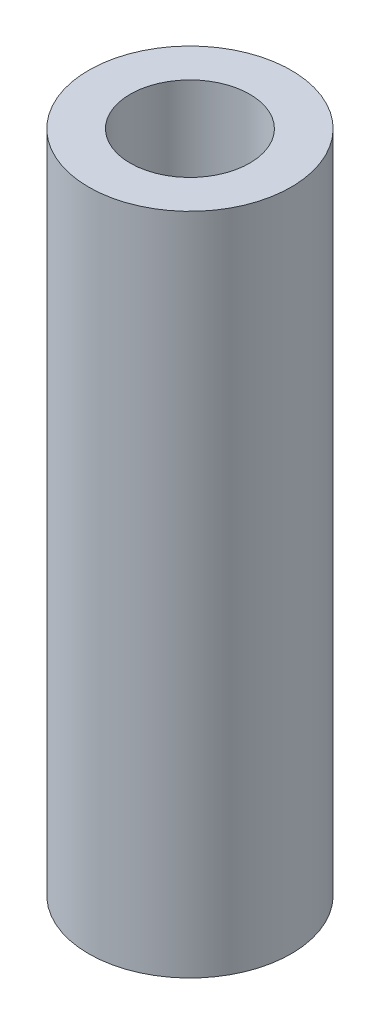
from build123d import *

# Parameters (mm, degrees)
CROQUIS_BASE_R          = 1.525
CROQUIS_BASE_R_2        = 0.9
SALIENTE_EXTRUIR1_DEPTH = 10


with BuildPart() as part:
    # Croquis base → Saliente-Extruir1 (new body)
    with BuildSketch(Plane(origin=(0, 0, 0), x_dir=(1, 0, 0), z_dir=(0, 1, 0))):
        with Locations(Location((0, 0, 0), (0, 0, 270))):
            Circle(CROQUIS_BASE_R)
        with Locations(Location((0, 0, 0), (0, 0, 270))):
            Circle(CROQUIS_BASE_R_2, mode=Mode.SUBTRACT)
    extrude(amount=SALIENTE_EXTRUIR1_DEPTH)


solid = part.part
